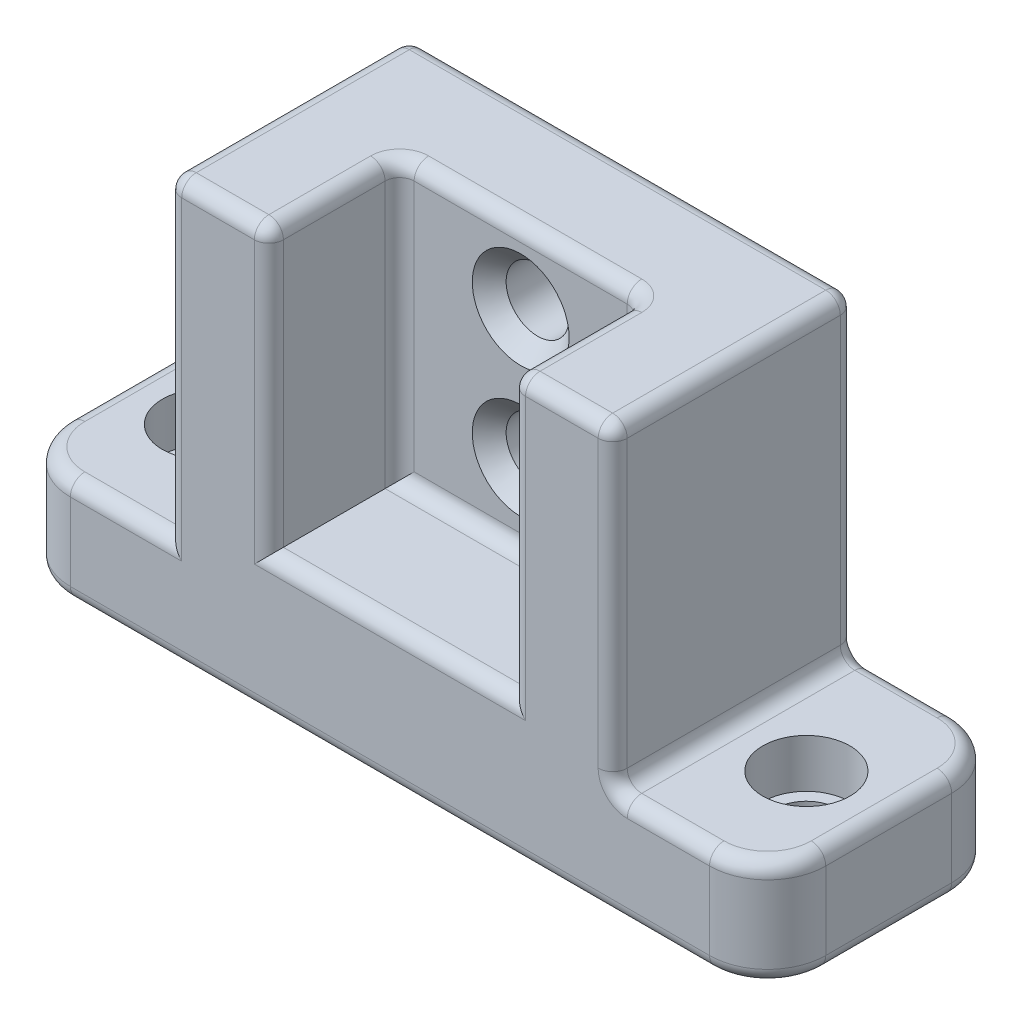
from build123d import *

# Parameters (mm, degrees)
SKETCH2_W           = 92
SKETCH2_H           = 87
BOSS_EXTRUDE1_DEPTH = 50
SKETCH4_W           = 50
SKETCH4_H           = 116
CUT_EXTRUDE1_DEPTH  = 27
SKETCH5_W           = 32
SKETCH5_H           = 50
BOSS_EXTRUDE2_DEPTH = 22
FILLET1_R           = 12
FILLET2_R           = 3
SKETCH7_R           = 6.5
CUT_EXTRUDE2_DEPTH  = 70
CHAMFER2_SIZE       = 3.5
CUT_EXTRUDE3_DEPTH  = 57
SKETCH10_R          = 9
CUT_EXTRUDE4_DEPTH  = 10


with BuildPart() as part:
    # Sketch2 → Boss-Extrude1 (new body)
    with BuildSketch(Plane.XY):
        Rectangle(SKETCH2_W, SKETCH2_H)
    extrude(amount=BOSS_EXTRUDE1_DEPTH)

    # Sketch4 → Cut-Extrude1 (cut)
    with BuildSketch(Plane.XY.offset(50)):
        with Locations((0, 43.5)):
            Rectangle(SKETCH4_W, SKETCH4_H)
    extrude(amount=-CUT_EXTRUDE1_DEPTH, mode=Mode.SUBTRACT)

    # Sketch5 → Boss-Extrude2 (add)
    with BuildSketch(Plane.XZ.offset(43.5)):
        with Locations((62, 25)):
            Rectangle(SKETCH5_W, SKETCH5_H)
        with Locations((-62, 25)):
            Rectangle(SKETCH5_W, SKETCH5_H)
    extrude(amount=-BOSS_EXTRUDE2_DEPTH)

    # Fillet1
    fillet1_edges = [part.edges().sort_by_distance(p)[0] for p in [
        (78, -32.5, 0),
        (78, -32.5, 50),
        (-78, -32.5, 50),
        (-78, -32.5, 0),
    ]]
    fillet(fillet1_edges, radius=FILLET1_R)

    # Fillet2
    fillet2_edges = [part.edges().sort_by_distance(p)[0] for p in [
        (-46, 11, 50),
        (-35.5, 43.5, 50),
        (25, 14.5, 50),
        (-25, 14.5, 50),
        (0, 43.5, 23),
        (25, 14.5, 23),
        (0, -14.5, 50),
        (-25, 43.5, 36.5),
        (-25, 14.5, 23),
        (0, -14.5, 23),
        (25, 43.5, 36.5),
        (46, 11, 0),
        (46, 11, 50),
        (56, -21.5, 0),
        (46, -21.5, 25),
        (56, -21.5, 50),
        (-46, 11, 0),
        (0, 43.5, 0),
        (-56, -21.5, 50),
        (0, -43.5, 50),
        (0, -43.5, 0),
        (78, -43.5, 25),
        (-78, -43.5, 25),
        (74.485281374, -43.5, 46.485281374),
        (74.485281374, -43.5, 3.514718626),
        (-74.485281374, -43.5, 3.514718626),
        (-74.485281374, -43.5, 46.485281374),
        (-78, -21.5, 25),
        (-56, -21.5, 0),
        (-74.485281374, -21.5, 3.514718626),
        (-74.485281374, -21.5, 46.485281374),
        (78, -21.5, 25),
        (74.485281374, -21.5, 46.485281374),
        (74.485281374, -21.5, 3.514718626),
        (-46, 43.5, 25),
        (46, 43.5, 25),
        (35.5, 43.5, 50),
    ]]
    fillet(fillet2_edges, radius=FILLET2_R)

    # Sketch7 → Cut-Extrude2 (cut)
    with BuildSketch(Plane.XY.offset(23)):
        with Locations((0, 28.5)):
            Circle(SKETCH7_R)
        with Locations((0, 1.5)):
            Circle(SKETCH7_R)
    extrude(amount=-CUT_EXTRUDE2_DEPTH, mode=Mode.SUBTRACT)

    # Chamfer2
    chamfer2_edges = [part.edges().sort_by_distance(p)[0] for p in [
        (-6.5, 28.5, 23),
        (-6.5, 1.5, 23),
    ]]
    chamfer(chamfer2_edges, length=CHAMFER2_SIZE)

    # Sketch9 → Cut-Extrude3 (cut)
    with BuildSketch(Plane(origin=(0, -21.5, 0), x_dir=(1, 0, 0), z_dir=(0, 1, 0))):
        with BuildLine():
            ThreePointArc((-62, -19.5), (-68.5, -26), (-62, -32.5))
            Line((-62, -32.5), (-62, -19.5))
        make_face()
        with BuildLine():
            Line((-62, -19.5), (-62, -32.5))
            ThreePointArc((-62, -32.5), (-57.403805922, -30.596194078), (-55.5, -26))
            ThreePointArc((-55.5, -26), (-57.403805922, -21.403805922), (-62, -19.5))
        make_face()
        with BuildLine():
            ThreePointArc((62, -19.5), (55.5, -26), (62, -32.5))
            Line((62, -32.5), (62, -19.5))
        make_face()
        with BuildLine():
            Line((62, -19.5), (62, -32.5))
            ThreePointArc((62, -32.5), (66.596194078, -30.596194078), (68.5, -26))
            ThreePointArc((68.5, -26), (66.596194078, -21.403805922), (62, -19.5))
        make_face()
    extrude(amount=-CUT_EXTRUDE3_DEPTH, mode=Mode.SUBTRACT)

    # Sketch10 → Cut-Extrude4 (cut)
    with BuildSketch(Plane(origin=(0, -21.5, 0), x_dir=(1, 0, 0), z_dir=(0, 1, 0))):
        with Locations(Location((-62, -26, 0), (0, 0, 270))):
            Circle(SKETCH10_R)
        with Locations(Location((62, -26, 0), (0, 0, 270))):
            Circle(SKETCH10_R)
    extrude(amount=-CUT_EXTRUDE4_DEPTH, mode=Mode.SUBTRACT)


solid = part.part
